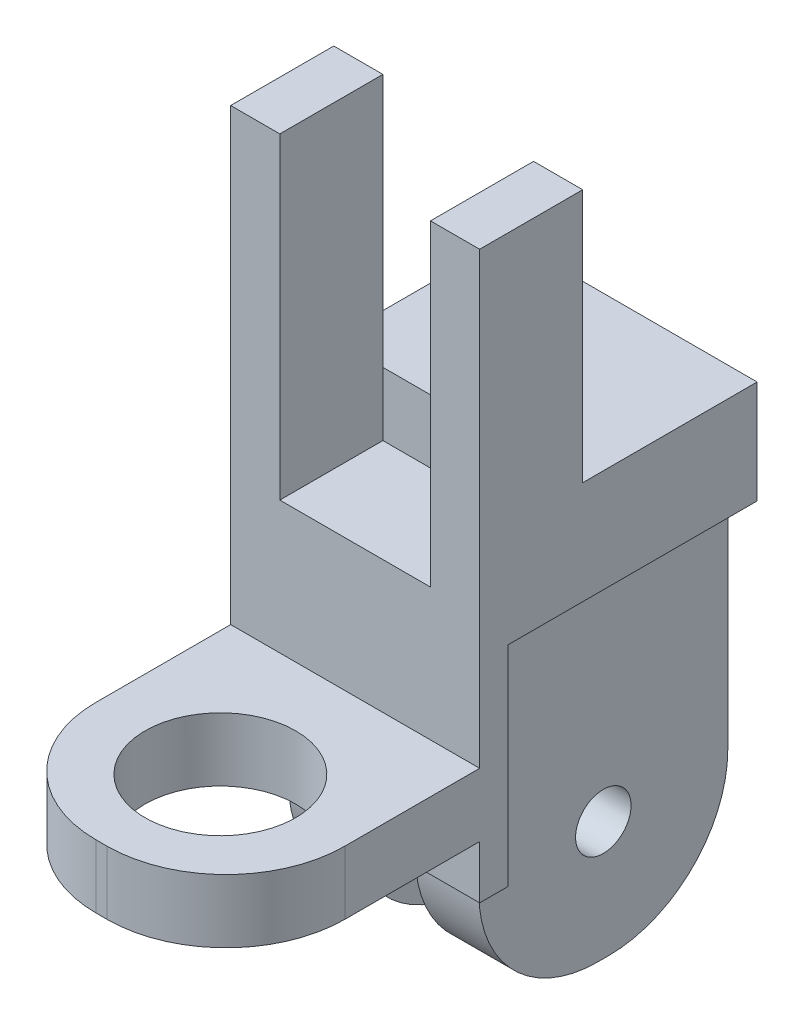
from build123d import *

# Parameters (mm, degrees)
SKETCH4_W            = 31.4
SKETCH4_H            = 31.4
SKETCH4_W_2          = 25.4
SKETCH4_H_2          = 25.4
BOSS_EXTRUDE3_DEPTH  = 30
SKETCH5_W            = 31.4
SKETCH5_H            = 31.4
BOSS_EXTRUDE4_DEPTH  = 5
SKETCH6_W            = 31.4
SKETCH6_H            = 8
BOSS_EXTRUDE5_DEPTH  = 5
BOSS_EXTRUDE6_DEPTH  = 8
SKETCH8_R            = 9.5
BOSS_EXTRUDE7_DEPTH  = 8
SKETCH9_W            = 31.4
SKETCH9_H            = 10
BOSS_EXTRUDE8_DEPTH  = 5
SKETCH10_W           = 31.4
SKETCH10_H           = 10
BOSS_EXTRUDE9_DEPTH  = 13
SKETCH11_W           = 6.2
SKETCH11_H           = 10
BOSS_EXTRUDE10_DEPTH = 40
BOSS_EXTRUDE11_DEPTH = 3
SKETCH13_W           = 31.4
SKETCH13_H           = 31.4
CUT_EXTRUDE1_DEPTH   = 31.4
SKETCH15_W           = 31.4
SKETCH15_H           = 13
BOSS_EXTRUDE12_DEPTH = 12
SKETCH17_W           = 8
SKETCH17_H           = 31.4
BOSS_EXTRUDE13_DEPTH = 10
SKETCH18_R           = 3.5
BOSS_EXTRUDE14_DEPTH = 8
SKETCH19_W           = 3.6
SKETCH19_H           = 5
CUT_EXTRUDE2_DEPTH   = 31.4
CUT_EXTRUDE3_START   = 8
SKETCH8_2_R          = 9.5
CUT_EXTRUDE3_DEPTH   = 24
SKETCH20_W           = 8
SKETCH20_H           = 1
CUT_EXTRUDE4_DEPTH   = 26.4


with BuildPart() as part:
    # Sketch4 → Boss-Extrude3 (new body)
    with BuildSketch(Plane.XY):
        Rectangle(SKETCH4_W, SKETCH4_H)
        Rectangle(SKETCH4_W_2, SKETCH4_H_2, mode=Mode.SUBTRACT)
    extrude(amount=BOSS_EXTRUDE3_DEPTH)

    # Sketch5 → Boss-Extrude4 (add)
    with BuildSketch(Plane.XY.offset(30)):
        Rectangle(SKETCH5_W, SKETCH5_H)
    extrude(amount=BOSS_EXTRUDE4_DEPTH)

    # Sketch6 → Boss-Extrude5 (add)
    with BuildSketch(Plane.XY.offset(35)):
        Rectangle(SKETCH6_W, SKETCH6_H)
    extrude(amount=BOSS_EXTRUDE5_DEPTH)

    # Sketch7 → Boss-Extrude6 (add)
    with BuildSketch(Plane.XZ.offset(4)):
        with BuildLine():
            Line((-15.7, 40), (-15.7, 52))
            ThreePointArc((-15.7, 52), (-11.306601718, 62.606601718), (-0.7, 67))
            Line((-0.7, 67), (0.7, 67))
            ThreePointArc((0.7, 67), (11.306601718, 62.606601718), (15.7, 52))
            Line((15.7, 52), (15.7, 40))
            Line((15.7, 40), (-15.7, 40))
        make_face()
    extrude(amount=-BOSS_EXTRUDE6_DEPTH)

    # Sketch8 → Boss-Extrude7 (add)
    with BuildSketch(Plane.XZ.offset(4)):
        with Locations((0, 52)):
            Circle(SKETCH8_R)
    boss_extrude7 = extrude(amount=BOSS_EXTRUDE7_DEPTH)

    # Mirror1: Boss-Extrude7 across plane
    add(boss_extrude7.mirror(Plane.ZX))

    # Sketch9 → Boss-Extrude8 (add)
    with BuildSketch(Plane(origin=(0, 15.7, 0), x_dir=(1, 0, 0), z_dir=(0, 1, 0))):
        with Locations((0, -27)):
            Rectangle(SKETCH9_W, SKETCH9_H)
    extrude(amount=BOSS_EXTRUDE8_DEPTH)

    # Sketch10 → Boss-Extrude9 (add)
    with BuildSketch(Plane(origin=(0, 15.7, 0), x_dir=(1, 0, 0), z_dir=(0, 1, 0))):
        with Locations((0, -17)):
            Rectangle(SKETCH10_W, SKETCH10_H)
    extrude(amount=BOSS_EXTRUDE9_DEPTH)

    # Sketch11 → Boss-Extrude10 (add)
    with BuildSketch(Plane(origin=(0, 20.7, 0), x_dir=(1, 0, 0), z_dir=(0, 1, 0))):
        with Locations((-12.6, -27)):
            Rectangle(SKETCH11_W, SKETCH11_H)
        with Locations((12.6, -27)):
            Rectangle(SKETCH11_W, SKETCH11_H)
    extrude(amount=BOSS_EXTRUDE10_DEPTH)

    # Sketch12 → Boss-Extrude11 (add)
    with BuildSketch(Plane.XY.offset(32)):
        Polygon((-15.7, 60.7), (-9.5, 60.7), (-9.5, 20.7), (9.5, 20.7), (9.5, 60.7), (15.7, 60.7), (15.7, 15.7), (-15.7, 15.7), align=None)
    extrude(amount=BOSS_EXTRUDE11_DEPTH)

    # Sketch13 → Cut-Extrude1 (cut)
    with BuildSketch(Plane.ZY.offset(15.7)):
        with Locations((15.7, 0)):
            Rectangle(SKETCH13_W, SKETCH13_H)
    extrude(amount=-CUT_EXTRUDE1_DEPTH, mode=Mode.SUBTRACT)

    # Sketch15 → Boss-Extrude12 (add)
    with BuildSketch(Plane(origin=(0, 0, 12), x_dir=(-1, 0, 0), z_dir=(0, 0, -1))):
        with Locations((0, 22.2)):
            Rectangle(SKETCH15_W, SKETCH15_H)
    extrude(amount=BOSS_EXTRUDE12_DEPTH)

    # Sketch17 → Boss-Extrude13 (add)
    with BuildSketch(Plane.XZ.offset(-15.7)):
        with Locations((-8, 15.7)):
            Rectangle(SKETCH17_W, SKETCH17_H)
    boss_extrude13 = extrude(amount=BOSS_EXTRUDE13_DEPTH)

    # Sketch18 → Boss-Extrude14 (add)
    with BuildSketch(Plane.ZY.offset(12)):
        with BuildLine():
            Line((31.4, 5.7), (0, 5.7))
            Line((0, 5.7), (0, -13.3))
            ThreePointArc((0, -13.3), (4.393398282, -23.906601718), (15, -28.3))
            Line((15, -28.3), (16.4, -28.3))
            ThreePointArc((16.4, -28.3), (27.006601718, -23.906601718), (31.4, -13.3))
            Line((31.4, -13.3), (31.4, 5.7))
        make_face()
        with Locations((15.7, -13.3)):
            Circle(SKETCH18_R, mode=Mode.SUBTRACT)
    boss_extrude14 = extrude(amount=-BOSS_EXTRUDE14_DEPTH)

    # Mirror3: Boss-Extrude13, Boss-Extrude14 across plane
    add(boss_extrude13.mirror(Plane(origin=(0, 0, 0), x_dir=(0, 0, 1), z_dir=(1, 0, 0))))
    add(boss_extrude14.mirror(Plane(origin=(0, 0, 0), x_dir=(0, 0, 1), z_dir=(1, 0, 0))))

    # Sketch19 → Cut-Extrude2 (cut)
    with BuildSketch(Plane(origin=(15.7, 0, 0), x_dir=(0, 0, -1), z_dir=(1, 0, 0))):
        with Locations((-33.2, -13.2)):
            Rectangle(SKETCH19_W, SKETCH19_H)
    extrude(amount=-CUT_EXTRUDE2_DEPTH, mode=Mode.SUBTRACT)

    # Sketch8<2> → Cut-Extrude3 (cut)
    with BuildSketch(Plane.XZ.offset(4).offset(CUT_EXTRUDE3_START)):
        with Locations((0, 52)):
            Circle(SKETCH8_2_R)
    extrude(amount=-CUT_EXTRUDE3_DEPTH, mode=Mode.SUBTRACT)

    # Sketch20 → Cut-Extrude4 (cut)
    with BuildSketch(Plane.XZ.offset(10.7)):
        with Locations((0, 31.9)):
            Rectangle(SKETCH20_W, SKETCH20_H)
    extrude(amount=-CUT_EXTRUDE4_DEPTH, mode=Mode.SUBTRACT)


solid = part.part
